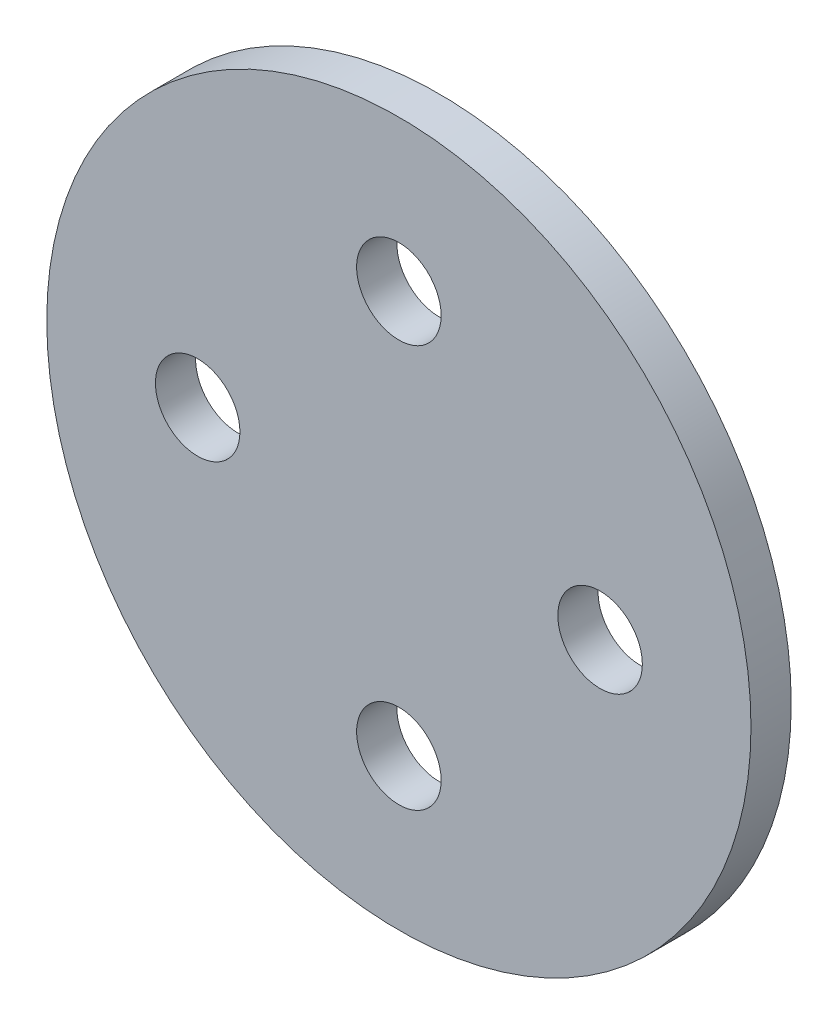
from build123d import *

# Parameters (mm, degrees)
SKETCH_1_R      = 17.5
SKETCH_1_R_2    = 2.1
EXTRUDE_1_DEPTH = 2


with BuildPart() as part:
    # 草图1 → 凸台-拉伸1 (new body)
    with BuildSketch(Plane.XY):
        Circle(SKETCH_1_R)
        with Locations((0, 10)):
            Circle(SKETCH_1_R_2, mode=Mode.SUBTRACT)
        with Locations((10, 0)):
            Circle(SKETCH_1_R_2, mode=Mode.SUBTRACT)
        with Locations((0, -10)):
            Circle(SKETCH_1_R_2, mode=Mode.SUBTRACT)
        with Locations((-10, 0)):
            Circle(SKETCH_1_R_2, mode=Mode.SUBTRACT)
    extrude(amount=EXTRUDE_1_DEPTH)


solid = part.part
